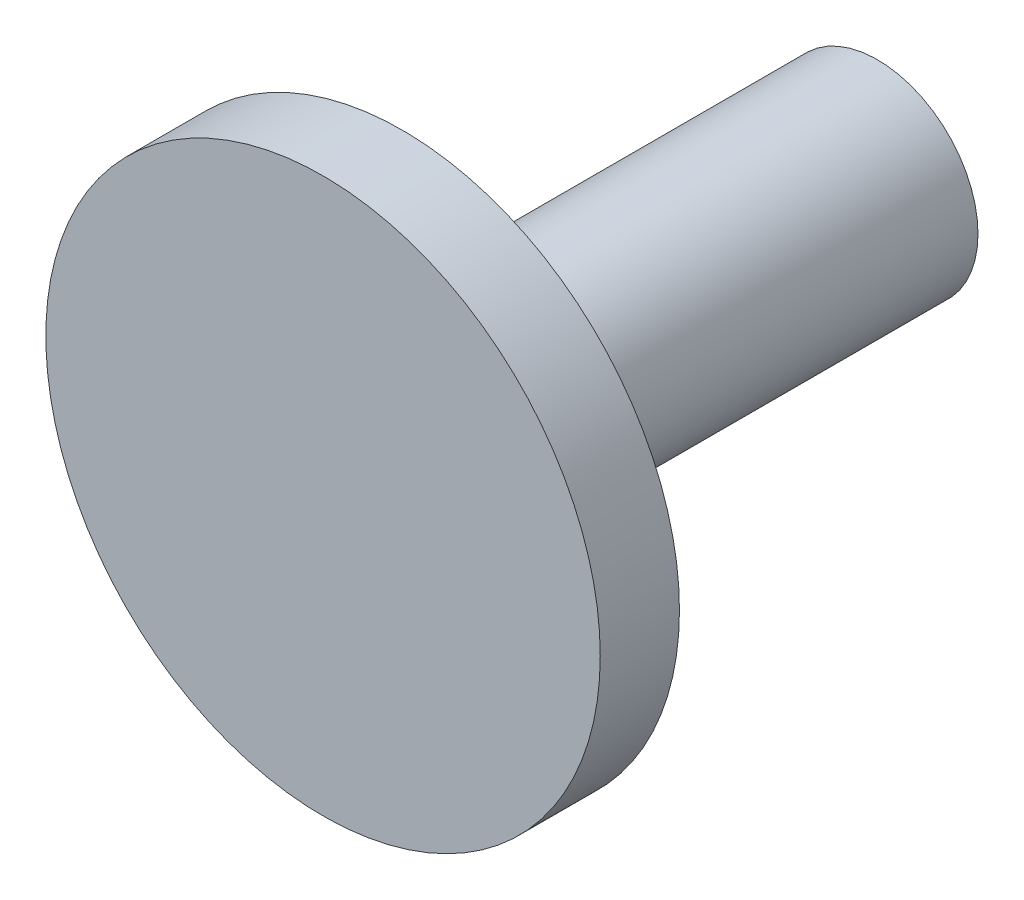
from build123d import *

# Parameters (mm, degrees)
SKETCH1_R           = 17.5
BOSS_EXTRUDE1_DEPTH = 5
SKETCH1_3_R         = 6.345
BOSS_EXTRUDE2_DEPTH = 30


with BuildPart() as part:
    # Sketch1 → Boss-Extrude1 (new body)
    with BuildSketch(Plane.XY):
        Circle(SKETCH1_R)
    extrude(amount=BOSS_EXTRUDE1_DEPTH)

    # Sketch1<3> → Boss-Extrude2 (add)
    with BuildSketch(Plane.XY):
        Circle(SKETCH1_3_R)
    extrude(amount=-BOSS_EXTRUDE2_DEPTH)


solid = part.part
